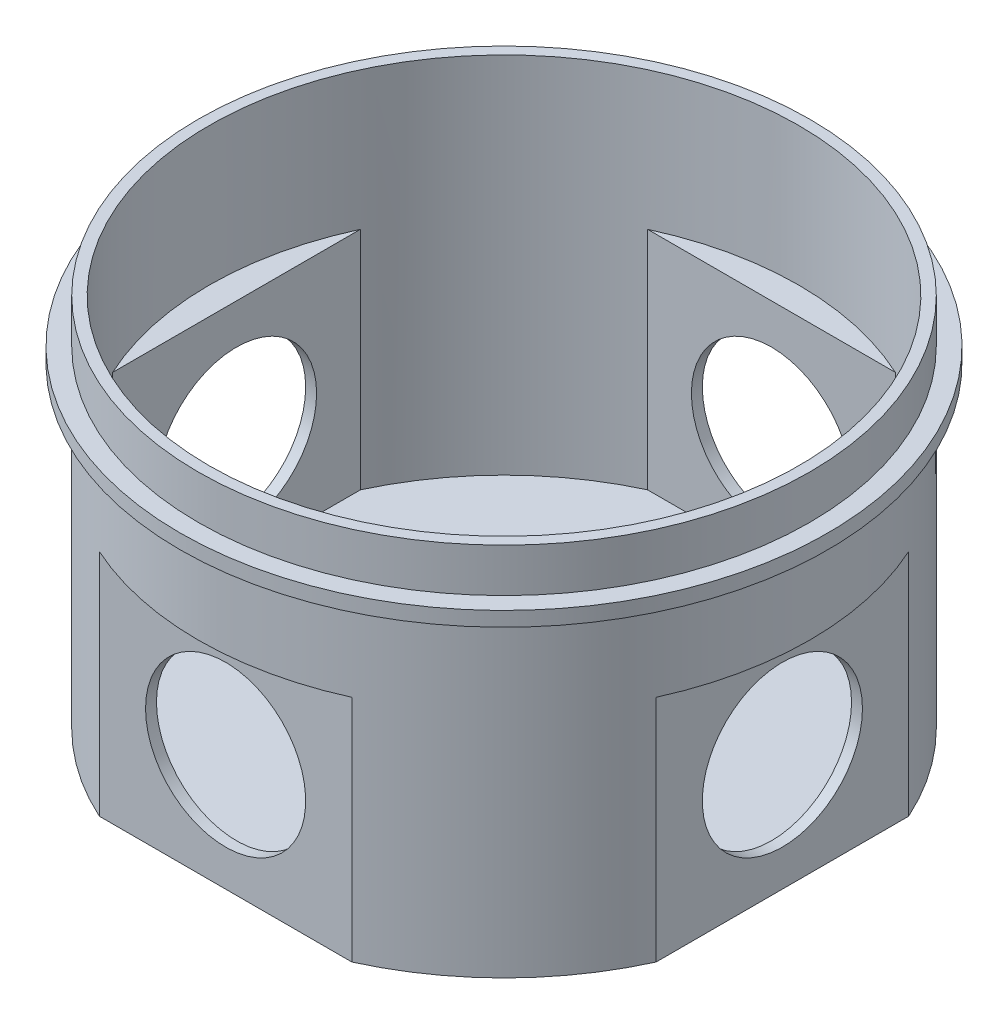
from build123d import *
from build123d.topology import SkipClean

# Parameters (mm, degrees)
EXTRUDE_1_DEPTH          = 1.5
EXTRUDE_2_DEPTH          = 30
EXTRUDE_3_DEPTH          = 1
SKETCH_4_R               = 42
SKETCH_4_R_2             = 40.5
EXTRUDE_4_DEPTH          = 11
SKETCH_5_R               = 44.50000000000001
SKETCH_5_R_2             = 40.5
EXTRUDE_5_DEPTH          = 2
SKETCH_6_R               = 42
SKETCH_6_R_2             = 40.5
EXTRUDE_6_DEPTH          = 6
SKETCH_7_R               = 11
CUT_EXTRUDE_1_DEPTH      = 108.14505354891564
PATTERN_CIRCULAR_1_COUNT = 2
PATTERN_CIRCULAR_1_ANGLE = 90.0000000000002


with BuildPart() as part:
    # Эскиз1 → Бобышка-Вытянуть1 (new body)
    with BuildSketch(Plane(origin=(0, 0, 0), x_dir=(1, 0, 0), z_dir=(0, 1, 0))):
        with BuildLine():
            Line((17.347550259331598, 38.25), (-17.347550259330436, 38.25))
            ThreePointArc((-17.347550259330443, 38.25000000000006), (-29.698484809834387, 29.698484809835605), (-38.24999999999934, 17.34755025933202))
            Line((-38.25, 17.34755025933216), (-38.25, -17.34755025933218))
            ThreePointArc((-38.249999999999325, -17.347550259332046), (-29.698484809834383, -29.698484809835612), (-17.34755025933046, -38.25000000000004))
            Line((-17.347550259330426, -38.25), (17.34755025933157, -38.25))
            ThreePointArc((17.347550259331467, -38.249999999999595), (29.69848480983491, -29.698484809835083), (38.24999999999949, -17.347550259331687))
            Line((38.25, -17.34755025933179), (38.25, 17.347550259331754))
            ThreePointArc((38.2499999999995, 17.347550259331655), (29.69848480983494, 29.69848480983505), (17.347550259331513, 38.249999999999574))
        make_face()
    extrude(amount=EXTRUDE_1_DEPTH)

    # Эскиз2 → Бобышка-Вытянуть2 (add)
    with BuildSketch(Plane(origin=(0, 1.5, 0), x_dir=(1, 0, 0), z_dir=(0, 1, 0))):
        with BuildLine():
            Line((-17.34755025933057, -38.25), (17.34755025933057, -38.25))
            ThreePointArc((17.34755025933057, -38.25), (29.698484809834998, -29.698484809834994), (38.25, -17.347550259330568))
            Line((38.25, -17.347550259330568), (38.25, 17.34755025933057))
            ThreePointArc((38.25, 17.34755025933057), (29.698484809834998, 29.698484809834994), (17.347550259330568, 38.25))
            Line((17.347550259330568, 38.25), (-17.34755025933057, 38.25))
            ThreePointArc((-17.34755025933057, 38.25), (-29.698484809834994, 29.698484809834998), (-38.25, 17.347550259330582))
            Line((-38.25, 17.347550259330582), (-38.25, -17.34755025933057))
            ThreePointArc((-38.25, -17.34755025933057), (-29.698484809834994, -29.698484809834998), (-17.34755025933057, -38.25))
        make_face()
        with BuildLine():
            Line((-17.020208576865333, -36.75), (17.020208576865333, -36.75))
            ThreePointArc((17.020208576865333, -36.75), (28.637824638055175, -28.63782463805517), (36.75, -17.020208576865333))
            Line((36.75, -17.020208576865333), (36.75, 17.020208576865333))
            ThreePointArc((36.75, 17.020208576865333), (28.637824638055175, 28.63782463805517), (17.020208576865333, 36.75))
            Line((17.020208576865333, 36.75), (-17.020208576865333, 36.75))
            ThreePointArc((-17.020208576865333, 36.75), (-28.63782463805517, 28.637824638055175), (-36.75, 17.020208576865333))
            Line((-36.75, 17.020208576865333), (-36.75, -17.020208576865333))
            ThreePointArc((-36.75, -17.020208576865333), (-28.63782463805517, -28.637824638055175), (-17.020208576865333, -36.75))
        make_face(mode=Mode.SUBTRACT)
    extrude(amount=EXTRUDE_2_DEPTH)

    # Эскиз3 → Бобышка-Вытянуть3 (add)
    with BuildSketch(Plane(origin=(0, 31.5, 0), x_dir=(1, 0, 0), z_dir=(0, 1, 0))):
        with BuildLine():
            Line((-38.25, -13.31117951197428), (-38.249999999999986, 13.311179511974292))
            ThreePointArc((-38.24999999999994, 13.311179511974292), (-40.5, 4.96e-15), (-38.24999999999996, -13.311179511974263))
        make_face()
        with BuildLine():
            ThreePointArc((-36.74999999999999, 17.02020857686534), (-37.545828318883174, 15.184227864759881), (-38.24999999999994, 13.311179511974292))
            Line((-38.249999999999986, 13.311179511974292), (-38.25, -13.31117951197428))
            ThreePointArc((-38.24999999999996, -13.311179511974263), (-37.54582831888318, -15.184227864759869), (-36.75, -17.02020857686533))
            Line((-36.75, -17.020208576865333), (-36.75, 17.02020857686534))
        make_face()
        with BuildLine():
            ThreePointArc((38.25, -17.347550259330568), (41.05179655021202, -8.874119674649448), (42, -1.029e-14))
            ThreePointArc((42, 0), (41.051796550212025, 8.874119674649428), (38.24999999999999, 17.347550259330575))
            Line((38.25, 17.347550259330568), (38.25, 13.311179511973094))
            ThreePointArc((38.25000000000035, 13.311179511973151), (39.933538535922494, 6.749999999999486), (40.5, 0))
            ThreePointArc((40.5, -9.92e-15), (39.933538535922494, -6.749999999999494), (38.25000000000033, -13.311179511973192))
            Line((38.25, -13.311179511973124), (38.25, -17.347550259330568))
        make_face()
        with BuildLine():
            ThreePointArc((40.5, 0), (39.933538535922494, 6.749999999999486), (38.25000000000035, 13.311179511973151))
            Line((38.25, 13.311179511973094), (38.25, -13.311179511973124))
            ThreePointArc((38.25000000000033, -13.311179511973192), (39.933538535922494, -6.749999999999494), (40.5, -9.92e-15))
        make_face()
        with BuildLine():
            Line((38.25, -13.311179511973124), (38.25, 13.311179511973094))
            ThreePointArc((38.25000000000035, 13.311179511973151), (37.5458283188834, 15.184227864759325), (36.75, 17.020208576865333))
            Line((36.75, 17.020208576865333), (36.75, -17.020208576865333))
            ThreePointArc((36.74999999999999, -17.020208576865343), (37.54582831888339, -15.18422786475935), (38.25000000000033, -13.311179511973192))
        make_face()
        with BuildLine():
            ThreePointArc((17.02020857686533, 36.75), (15.18422786475986, 37.54582831888318), (13.311179511974236, 38.249999999999964))
            Line((13.311179511974245, 38.25000000000001), (-13.311179511974242, 38.25))
            ThreePointArc((-13.311179511974233, 38.249999999999964), (-15.184227864759857, 37.54582831888318), (-17.020208576865333, 36.75))
            Line((-17.020208576865333, 36.75), (17.020208576865326, 36.75000000000001))
        make_face()
        with BuildLine():
            Line((-13.311179511974242, 38.25), (13.311179511974245, 38.25000000000001))
            ThreePointArc((13.311179511974236, 38.249999999999964), (2.48e-15, 40.5), (-13.311179511974233, 38.249999999999964))
        make_face()
        with BuildLine():
            Line((13.311179511974245, 38.25000000000001), (17.347550259330564, 38.25000000000001))
            ThreePointArc((17.34755025933056, 38.25000000000001), (-6.75e-15, 42), (-17.34755025933057, 38.25))
            Line((-17.34755025933057, 38.25), (-13.311179511974242, 38.25))
            ThreePointArc((-13.311179511974233, 38.249999999999964), (2.48e-15, 40.5), (13.311179511974236, 38.249999999999964))
        make_face()
        with BuildLine():
            ThreePointArc((-17.347550259330596, -38.249999999999986), (-7.72e-15, -42), (17.347550259330582, -38.24999999999999))
            Line((17.34755025933057, -38.25), (13.311179511974295, -38.25))
            ThreePointArc((13.311179511974295, -38.24999999999994), (2.853e-14, -40.5), (-13.311179511974242, -38.249999999999964))
            Line((-13.311179511974242, -38.25), (-17.34755025933057, -38.25))
        make_face()
        with BuildLine():
            ThreePointArc((-13.311179511974242, -38.249999999999964), (2.853e-14, -40.5), (13.311179511974295, -38.24999999999994))
            Line((13.311179511974295, -38.25), (-13.311179511974242, -38.25))
        make_face()
        with BuildLine():
            Line((-13.311179511974242, -38.25), (13.311179511974295, -38.25))
            ThreePointArc((13.311179511974295, -38.24999999999994), (15.184227864759867, -37.54582831888318), (17.02020857686533, -36.75))
            Line((17.020208576865333, -36.75), (-17.020208576865333, -36.75))
            ThreePointArc((-17.020208576865343, -36.74999999999999), (-15.18422786475985, -37.54582831888319), (-13.311179511974242, -38.249999999999964))
        make_face()
        with BuildLine():
            ThreePointArc((-38.25, -17.347550259330568), (-29.698484809835, -29.698484809834994), (-17.347550259330596, -38.249999999999986))
            Line((-17.34755025933057, -38.25), (-13.311179511974242, -38.25))
            ThreePointArc((-13.311179511974242, -38.249999999999964), (-15.18422786475985, -37.54582831888319), (-17.020208576865343, -36.74999999999999))
            ThreePointArc((-17.020208576865343, -36.74999999999999), (-28.637824638055182, -28.63782463805517), (-36.75, -17.02020857686533))
            ThreePointArc((-36.75, -17.02020857686533), (-37.54582831888318, -15.184227864759869), (-38.24999999999996, -13.311179511974263))
            Line((-38.25, -13.31117951197428), (-38.25, -17.34755025933057))
        make_face()
        with BuildLine():
            ThreePointArc((17.347550259330582, -38.24999999999999), (29.698484809835016, -29.698484809834973), (38.25, -17.347550259330568))
            Line((38.25, -17.347550259330568), (38.25, -13.311179511973124))
            ThreePointArc((38.25000000000033, -13.311179511973192), (37.54582831888339, -15.18422786475935), (36.74999999999999, -17.020208576865343))
            ThreePointArc((36.74999999999999, -17.020208576865343), (28.637824638055168, -28.637824638055182), (17.02020857686533, -36.75))
            ThreePointArc((17.02020857686533, -36.75), (15.184227864759867, -37.54582831888318), (13.311179511974295, -38.24999999999994))
            Line((13.311179511974295, -38.25), (17.34755025933057, -38.25))
        make_face()
        with BuildLine():
            Line((38.25, 13.311179511973094), (38.25, 17.347550259330568))
            ThreePointArc((38.24999999999999, 17.347550259330575), (29.698484809834987, 29.698484809835), (17.34755025933056, 38.25000000000001))
            Line((17.347550259330564, 38.25000000000001), (13.311179511974245, 38.25000000000001))
            ThreePointArc((13.311179511974236, 38.249999999999964), (15.18422786475986, 37.54582831888318), (17.02020857686533, 36.75))
            ThreePointArc((17.02020857686533, 36.75), (28.637824638055175, 28.63782463805517), (36.75, 17.020208576865333))
            ThreePointArc((36.75, 17.020208576865333), (37.5458283188834, 15.184227864759325), (38.25000000000035, 13.311179511973151))
        make_face()
        with BuildLine():
            Line((-13.311179511974242, 38.25), (-17.34755025933057, 38.25))
            ThreePointArc((-17.34755025933057, 38.25), (-29.69848480983498, 29.698484809835012), (-38.24999999999998, 17.347550259330614))
            Line((-38.249999999999986, 17.3475502593306), (-38.249999999999986, 13.311179511974292))
            ThreePointArc((-38.24999999999994, 13.311179511974292), (-37.545828318883174, 15.184227864759881), (-36.74999999999999, 17.02020857686534))
            ThreePointArc((-36.74999999999999, 17.02020857686534), (-28.63782463805517, 28.637824638055175), (-17.020208576865333, 36.75))
            ThreePointArc((-17.020208576865333, 36.75), (-15.184227864759857, 37.54582831888318), (-13.311179511974233, 38.249999999999964))
        make_face()
        with BuildLine():
            Line((-38.249999999999986, 13.311179511974292), (-38.249999999999986, 17.3475502593306))
            ThreePointArc((-38.24999999999998, 17.347550259330614), (-42, 2.38e-14), (-38.25, -17.347550259330568))
            Line((-38.25, -17.34755025933057), (-38.25, -13.31117951197428))
            ThreePointArc((-38.24999999999996, -13.311179511974263), (-40.5, 4.96e-15), (-38.24999999999994, 13.311179511974292))
        make_face()
    extrude(amount=EXTRUDE_3_DEPTH)

    # Эскиз4 → Бобышка-Вытянуть4 (add)
    with SkipClean():  # the faces are left unmerged after this step: merging them gives an invalid solid
        with BuildSketch(Plane(origin=(0, 32.5, 0), x_dir=(1, 0, 0), z_dir=(0, 1, 0))):
            with Locations(Location((0, 0, 0), (0, 0, 65.604247888))):
                Circle(SKETCH_4_R)
            with Locations(Location((0, 0, 0), (0, 0, 65.14949766))):
                Circle(SKETCH_4_R_2, mode=Mode.SUBTRACT)
        extrude(amount=EXTRUDE_4_DEPTH)

    # Эскиз5 → Бобышка-Вытянуть5 (add)
    with BuildSketch(Plane(origin=(0, 43.5, 0), x_dir=(1, 0, 0), z_dir=(0, 1, 0))):
        with Locations(Location((0, 0, 0), (0, 0, 270))):
            Circle(SKETCH_5_R)
        with Locations(Location((0, 0, 0), (0, 0, 65.14949766))):
            Circle(SKETCH_5_R_2, mode=Mode.SUBTRACT)
    extrude(amount=EXTRUDE_5_DEPTH)

    # Эскиз6 → Бобышка-Вытянуть6 (add)
    with BuildSketch(Plane(origin=(0, 45.5, 0), x_dir=(1, 0, 0), z_dir=(0, 1, 0))):
        with Locations(Location((0, 0, 0), (0, 0, 65.604247888))):
            Circle(SKETCH_6_R)
        with Locations(Location((0, 0, 0), (0, 0, 65.14949766))):
            Circle(SKETCH_6_R_2, mode=Mode.SUBTRACT)
    extrude(amount=EXTRUDE_6_DEPTH)

    # Эскиз7 → Вырез-Вытянуть1 (cut, through all)
    with BuildSketch(Plane(origin=(38.25, 0, 0), x_dir=(0, 0, -1), z_dir=(1, 0, 0))):
        with Locations((0, 16)):
            Circle(SKETCH_7_R)
    cut_extrude_1 = extrude(amount=-CUT_EXTRUDE_1_DEPTH, mode=Mode.SUBTRACT)

    # Круговой массив1: Вырез-Вытянуть1 ×2 about axis
    pattern_circular_1_axis = Axis((0, 0, 0), (0, -1, 0))
    for i in range(1, PATTERN_CIRCULAR_1_COUNT):
        add(cut_extrude_1.rotate(pattern_circular_1_axis, i * PATTERN_CIRCULAR_1_ANGLE / (PATTERN_CIRCULAR_1_COUNT - 1)), mode=Mode.SUBTRACT)


solid = part.part
